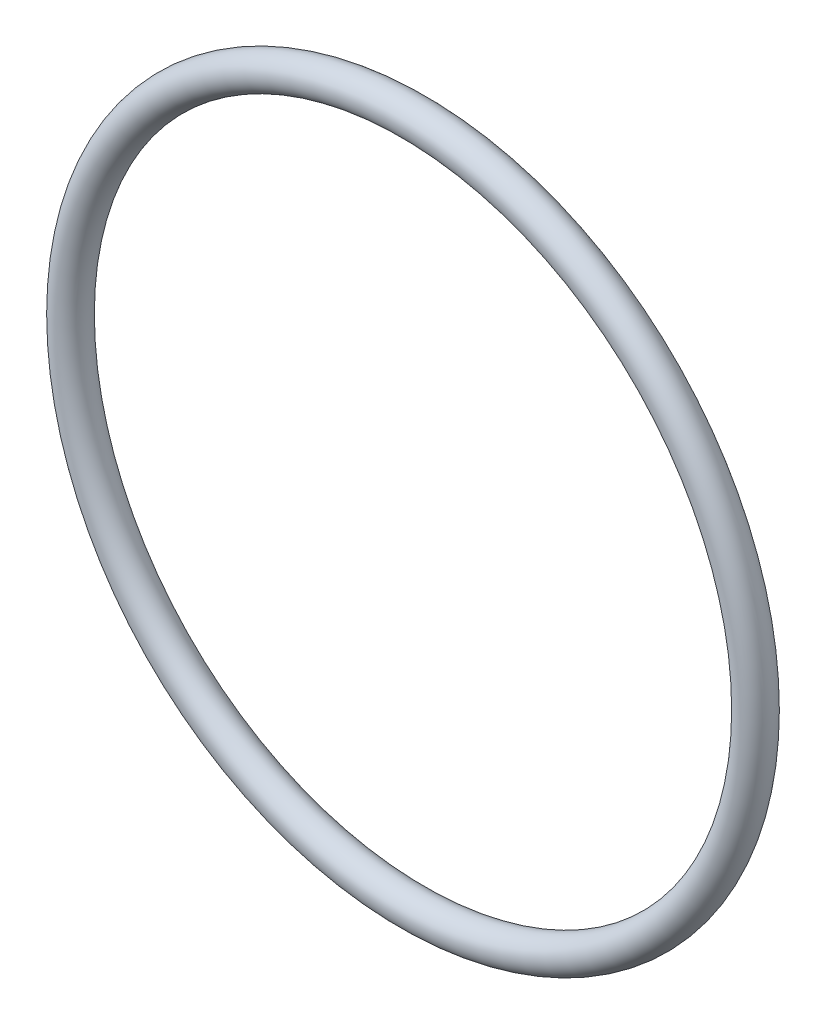
from build123d import *

# Parameters (mm, degrees)
SKETCH2_R = 1.3081


with BuildPart() as part:
    # Sketch2 → Revolve1 (revolve)
    with BuildSketch(Plane(origin=(0, 0, 0), x_dir=(1, 0, 0), z_dir=(0, 1, 0)), mode=Mode.PRIVATE) as revolve1_sk:
        with Locations((-26.543, 0)):
            Circle(SKETCH2_R)
    revolve(revolve1_sk.sketch.rotate(Axis((0, 0, 1.3081), (0, 0, -1)), 180), axis=Axis((0, 0, 1.3081), (0, 0, -1)))


solid = part.part
